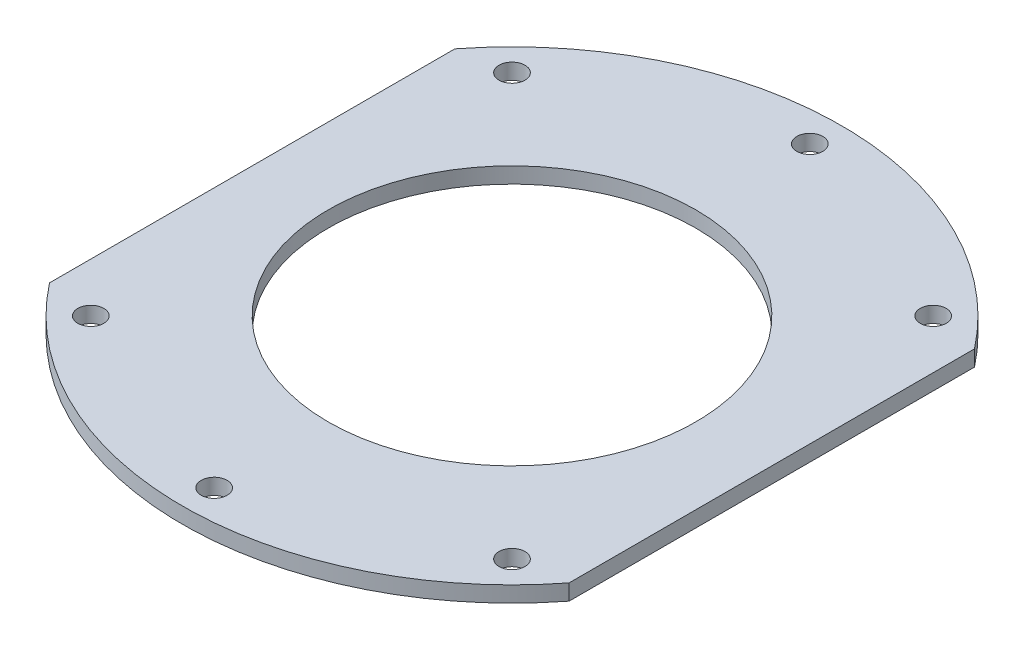
from build123d import *

# Parameters (mm, degrees)
SKETCH_1_R          = 52
SKETCH_1_R_2        = 29
SKETCH_1_R_3        = 2.05
EXTRUDE_1_DEPTH     = 2.5
SKETCH_2_W          = 182
SKETCH_2_H          = 210.035227354
SKETCH_2_W_2        = 82
SKETCH_2_H_2        = 110.035227354
CUT_EXTRUDE_1_DEPTH = 4


with BuildPart() as part:
    # 草图1 → 凸台-拉伸1 (new body)
    with BuildSketch(Plane(origin=(0, 0, 0), x_dir=(1, 0, 0), z_dir=(0, 1, 0))):
        with Locations(Location((0, 0, 0), (0, 0, 270))):
            Circle(SKETCH_1_R)
        with Locations(Location((0, 0, 0), (0, 0, 270))):
            Circle(SKETCH_1_R_2, mode=Mode.SUBTRACT)
        with Locations(Location((47, 0, 0), (0, 0, 270))):
            Circle(SKETCH_1_R_3, mode=Mode.SUBTRACT)
        with Locations(Location((33.234018716, -33.234018716, 0), (0, 0, 270))):
            Circle(SKETCH_1_R_3, mode=Mode.SUBTRACT)
        with Locations(Location((0, -47, 0), (0, 0, 270))):
            Circle(SKETCH_1_R_3, mode=Mode.SUBTRACT)
        with Locations(Location((-33.234018716, -33.234018716, 0), (0, 0, 270))):
            Circle(SKETCH_1_R_3, mode=Mode.SUBTRACT)
        with Locations(Location((-47, 0, 0), (0, 0, 270))):
            Circle(SKETCH_1_R_3, mode=Mode.SUBTRACT)
        with Locations(Location((-33.234018716, 33.234018716, 0), (0, 0, 270))):
            Circle(SKETCH_1_R_3, mode=Mode.SUBTRACT)
        with Locations(Location((0, 47, 0), (0, 0, 270))):
            Circle(SKETCH_1_R_3, mode=Mode.SUBTRACT)
        with Locations(Location((33.234018716, 33.234018716, 0), (0, 0, 270))):
            Circle(SKETCH_1_R_3, mode=Mode.SUBTRACT)
    extrude(amount=EXTRUDE_1_DEPTH)

    # 草图2 → 切除-拉伸-薄壁1 (cut)
    with BuildSketch(Plane(origin=(0, 2.5, 0), x_dir=(1, 0, 0), z_dir=(0, 1, 0))):
        Rectangle(SKETCH_2_W, SKETCH_2_H)
        Rectangle(SKETCH_2_W_2, SKETCH_2_H_2, mode=Mode.SUBTRACT)
    extrude(amount=-CUT_EXTRUDE_1_DEPTH, mode=Mode.SUBTRACT)


solid = part.part
